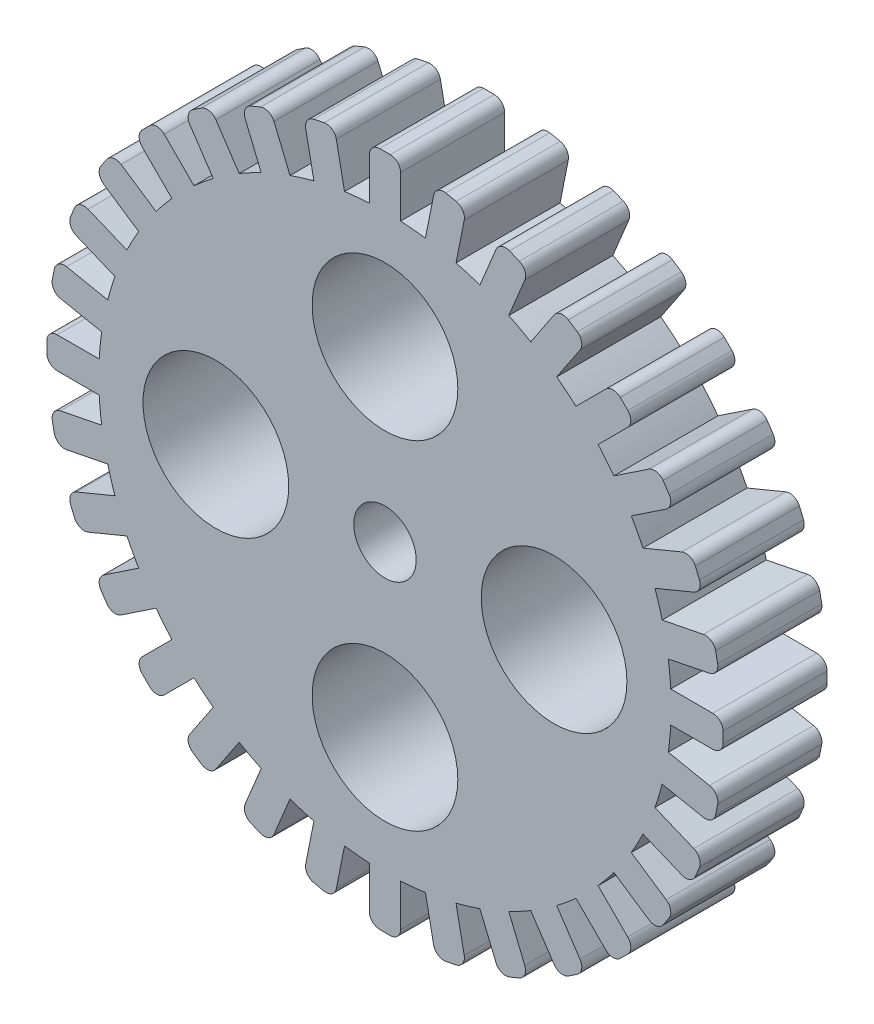
from build123d import *

# Parameters (mm, degrees)
SKETCH1_R           = 3
BOSS_EXTRUDE2_DEPTH = 10
FILLET1_R           = 1
SKETCH2_R           = 7
CUT_EXTRUDE1_DEPTH  = 24


with BuildPart() as part:
    # Sketch1 → Boss-Extrude2 (new body)
    with BuildSketch(Plane.XY):
        with BuildLine():
            Line((4.862500818, 32.134188737), (3.885819022, 27.224077772))
            ThreePointArc((3.885819022, 27.224077772), (2.695471359, 27.367579983), (1.5, 27.459060435))
            Line((1.5, 27.459060435), (1.5, 32.465366161))
            ThreePointArc((1.5, 32.465366161), (0, 32.5), (-1.5, 32.465366161))
            Line((-1.5, 32.465366161), (-1.5, 27.459060435))
            ThreePointArc((-1.5, 27.459060435), (-2.695471359, 27.367579983), (-3.885819022, 27.224077772))
            Line((-3.885819022, 27.224077772), (-4.862500818, 32.134188737))
            ThreePointArc((-4.862500818, 32.134188737), (-6.340435466, 31.875521613), (-7.804856659, 31.548917771))
            Line((-7.804856659, 31.548917771), (-6.828174863, 26.638806806))
            ThreePointArc((-6.828174863, 26.638806806), (-7.982828624, 26.315859233), (-9.122308198, 25.942889067))
            Line((-9.122308198, 25.942889067), (-11.038138457, 30.568112461))
            ThreePointArc((-11.038138457, 30.568112461), (-12.437211552, 30.026084807), (-13.809777054, 29.420062164))
            Line((-13.809777054, 29.420062164), (-11.893946796, 24.79483877))
            ThreePointArc((-11.893946796, 24.79483877), (-12.963410263, 24.25283477), (-14.008232186, 23.664729684))
            Line((-14.008232186, 23.664729684), (-16.789586625, 27.827320765))
            ThreePointArc((-16.789586625, 27.827320765), (-18.056032573, 27.0227624), (-19.283995462, 26.160610066))
            Line((-19.283995462, 26.160610066), (-16.502641023, 21.998018985))
            ThreePointArc((-16.502641023, 21.998018985), (-17.445815314, 21.257787467), (-18.355827667, 20.477148011))
            Line((-18.355827667, 20.477148011), (-21.895820395, 24.017140738))
            ThreePointArc((-21.895820395, 24.017140738), (-22.980970389, 22.980970389), (-24.017140738, 21.895820395))
            Line((-24.017140738, 21.895820395), (-20.477148011, 18.355827667))
            ThreePointArc((-20.477148011, 18.355827667), (-21.257787467, 17.445815315), (-21.998018985, 16.502641023))
            Line((-21.998018985, 16.502641023), (-26.160610066, 19.283995462))
            ThreePointArc((-26.160610066, 19.283995462), (-27.0227624, 18.056032573), (-27.827320765, 16.789586625))
            Line((-27.827320765, 16.789586625), (-23.664729684, 14.008232186))
            ThreePointArc((-23.664729684, 14.008232186), (-24.25283477, 12.963410263), (-24.79483877, 11.893946796))
            Line((-24.79483877, 11.893946796), (-29.420062164, 13.809777054))
            ThreePointArc((-29.420062164, 13.809777054), (-30.026084807, 12.437211552), (-30.568112461, 11.038138457))
            Line((-30.568112461, 11.038138457), (-25.942889067, 9.122308198))
            ThreePointArc((-25.942889067, 9.122308198), (-26.315859233, 7.982828624), (-26.638806806, 6.828174863))
            Line((-26.638806806, 6.828174863), (-31.548917771, 7.804856659))
            ThreePointArc((-31.548917771, 7.804856659), (-31.875521613, 6.340435466), (-32.134188737, 4.862500818))
            Line((-32.134188737, 4.862500818), (-27.224077772, 3.885819022))
            ThreePointArc((-27.224077772, 3.885819022), (-27.367579983, 2.695471359), (-27.459060435, 1.5))
            Line((-27.459060435, 1.5), (-32.465366161, 1.5))
            ThreePointArc((-32.465366161, 1.5), (-32.5, 0), (-32.465366161, -1.5))
            Line((-32.465366161, -1.5), (-27.459060435, -1.5))
            ThreePointArc((-27.459060435, -1.5), (-27.367579983, -2.695471359), (-27.224077772, -3.885819022))
            Line((-27.224077772, -3.885819022), (-32.134188737, -4.862500818))
            ThreePointArc((-32.134188737, -4.862500818), (-31.875521613, -6.340435466), (-31.548917771, -7.804856659))
            Line((-31.548917771, -7.804856659), (-26.638806806, -6.828174863))
            ThreePointArc((-26.638806806, -6.828174863), (-26.315859233, -7.982828624), (-25.942889067, -9.122308198))
            Line((-25.942889067, -9.122308198), (-30.568112461, -11.038138457))
            ThreePointArc((-30.568112461, -11.038138457), (-30.026084807, -12.437211552), (-29.420062164, -13.809777054))
            Line((-29.420062164, -13.809777054), (-24.79483877, -11.893946796))
            ThreePointArc((-24.79483877, -11.893946796), (-24.25283477, -12.963410263), (-23.664729684, -14.008232186))
            Line((-23.664729684, -14.008232186), (-27.827320765, -16.789586625))
            ThreePointArc((-27.827320765, -16.789586625), (-27.0227624, -18.056032573), (-26.160610066, -19.283995462))
            Line((-26.160610066, -19.283995462), (-21.998018985, -16.502641023))
            ThreePointArc((-21.998018985, -16.502641023), (-21.257787467, -17.445815315), (-20.477148011, -18.355827667))
            Line((-20.477148011, -18.355827667), (-24.017140738, -21.895820395))
            ThreePointArc((-24.017140738, -21.895820395), (-22.980970389, -22.980970389), (-21.895820395, -24.017140738))
            Line((-21.895820395, -24.017140738), (-18.355827667, -20.477148011))
            ThreePointArc((-18.355827667, -20.477148011), (-17.445815315, -21.257787467), (-16.502641023, -21.998018985))
            Line((-16.502641023, -21.998018985), (-19.283995462, -26.160610066))
            ThreePointArc((-19.283995462, -26.160610066), (-18.056032573, -27.0227624), (-16.789586625, -27.827320765))
            Line((-16.789586625, -27.827320765), (-14.008232186, -23.664729684))
            ThreePointArc((-14.008232186, -23.664729684), (-12.963410263, -24.25283477), (-11.893946796, -24.79483877))
            Line((-11.893946796, -24.79483877), (-13.809777054, -29.420062164))
            ThreePointArc((-13.809777054, -29.420062164), (-12.437211552, -30.026084807), (-11.038138457, -30.568112461))
            Line((-11.038138457, -30.568112461), (-9.122308198, -25.942889067))
            ThreePointArc((-9.122308198, -25.942889067), (-7.982828624, -26.315859233), (-6.828174863, -26.638806806))
            Line((-6.828174863, -26.638806806), (-7.804856659, -31.548917771))
            ThreePointArc((-7.804856659, -31.548917771), (-6.340435466, -31.875521613), (-4.862500818, -32.134188737))
            Line((-4.862500818, -32.134188737), (-3.885819022, -27.224077772))
            ThreePointArc((-3.885819022, -27.224077772), (-2.695471359, -27.367579983), (-1.5, -27.459060435))
            Line((-1.5, -27.459060435), (-1.5, -32.465366161))
            ThreePointArc((-1.5, -32.465366161), (0, -32.5), (1.5, -32.465366161))
            Line((1.5, -32.465366161), (1.5, -27.459060435))
            ThreePointArc((1.5, -27.459060435), (2.695471359, -27.367579983), (3.885819022, -27.224077772))
            Line((3.885819022, -27.224077772), (4.862500818, -32.134188737))
            ThreePointArc((4.862500818, -32.134188737), (6.340435466, -31.875521613), (7.804856659, -31.548917771))
            Line((7.804856659, -31.548917771), (6.828174863, -26.638806806))
            ThreePointArc((6.828174863, -26.638806806), (7.982828624, -26.315859233), (9.122308198, -25.942889067))
            Line((9.122308198, -25.942889067), (11.038138457, -30.568112461))
            ThreePointArc((11.038138457, -30.568112461), (12.437211552, -30.026084807), (13.809777054, -29.420062164))
            Line((13.809777054, -29.420062164), (11.893946796, -24.79483877))
            ThreePointArc((11.893946796, -24.79483877), (12.963410263, -24.25283477), (14.008232186, -23.664729684))
            Line((14.008232186, -23.664729684), (16.789586625, -27.827320765))
            ThreePointArc((16.789586625, -27.827320765), (18.056032573, -27.0227624), (19.283995462, -26.160610066))
            Line((19.283995462, -26.160610066), (16.502641023, -21.998018985))
            ThreePointArc((16.502641023, -21.998018985), (17.445815315, -21.257787467), (18.355827667, -20.477148011))
            Line((18.355827667, -20.477148011), (21.895820395, -24.017140738))
            ThreePointArc((21.895820395, -24.017140738), (22.980970389, -22.980970389), (24.017140738, -21.895820395))
            Line((24.017140738, -21.895820395), (20.477148011, -18.355827667))
            ThreePointArc((20.477148011, -18.355827667), (21.257787467, -17.445815315), (21.998018985, -16.502641023))
            Line((21.998018985, -16.502641023), (26.160610066, -19.283995462))
            ThreePointArc((26.160610066, -19.283995462), (27.0227624, -18.056032573), (27.827320765, -16.789586625))
            Line((27.827320765, -16.789586625), (23.664729684, -14.008232186))
            ThreePointArc((23.664729684, -14.008232186), (24.25283477, -12.963410263), (24.79483877, -11.893946796))
            Line((24.79483877, -11.893946796), (29.420062164, -13.809777054))
            ThreePointArc((29.420062164, -13.809777054), (30.026084807, -12.437211552), (30.568112461, -11.038138457))
            Line((30.568112461, -11.038138457), (25.942889067, -9.122308198))
            ThreePointArc((25.942889067, -9.122308198), (26.315859233, -7.982828624), (26.638806806, -6.828174863))
            Line((26.638806806, -6.828174863), (31.548917771, -7.804856659))
            ThreePointArc((31.548917771, -7.804856659), (31.875521613, -6.340435466), (32.134188737, -4.862500818))
            Line((32.134188737, -4.862500818), (27.224077772, -3.885819022))
            ThreePointArc((27.224077772, -3.885819022), (27.367579983, -2.695471359), (27.459060435, -1.5))
            Line((27.459060435, -1.5), (32.465366161, -1.5))
            ThreePointArc((32.465366161, -1.5), (32.5, 0), (32.465366161, 1.5))
            Line((32.465366161, 1.5), (27.459060435, 1.5))
            ThreePointArc((27.459060435, 1.5), (27.367579983, 2.695471359), (27.224077772, 3.885819022))
            Line((27.224077772, 3.885819022), (32.134188737, 4.862500818))
            ThreePointArc((32.134188737, 4.862500818), (31.875521613, 6.340435466), (31.548917771, 7.804856659))
            Line((31.548917771, 7.804856659), (26.638806806, 6.828174863))
            ThreePointArc((26.638806806, 6.828174863), (26.315859233, 7.982828624), (25.942889067, 9.122308198))
            Line((25.942889067, 9.122308198), (30.568112461, 11.038138457))
            ThreePointArc((30.568112461, 11.038138457), (30.026084807, 12.437211552), (29.420062164, 13.809777054))
            Line((29.420062164, 13.809777054), (24.79483877, 11.893946796))
            ThreePointArc((24.79483877, 11.893946796), (24.25283477, 12.963410263), (23.664729684, 14.008232186))
            Line((23.664729684, 14.008232186), (27.827320765, 16.789586625))
            ThreePointArc((27.827320765, 16.789586625), (27.0227624, 18.056032573), (26.160610066, 19.283995462))
            Line((26.160610066, 19.283995462), (21.998018985, 16.502641023))
            ThreePointArc((21.998018985, 16.502641023), (21.257787467, 17.445815315), (20.477148011, 18.355827667))
            Line((20.477148011, 18.355827667), (24.017140738, 21.895820395))
            ThreePointArc((24.017140738, 21.895820395), (22.980970389, 22.980970389), (21.895820395, 24.017140738))
            Line((21.895820395, 24.017140738), (18.355827667, 20.477148011))
            ThreePointArc((18.355827667, 20.477148011), (17.445815315, 21.257787467), (16.502641023, 21.998018985))
            Line((16.502641023, 21.998018985), (19.283995462, 26.160610066))
            ThreePointArc((19.283995462, 26.160610066), (18.056032573, 27.0227624), (16.789586625, 27.827320765))
            Line((16.789586625, 27.827320765), (14.008232186, 23.664729684))
            ThreePointArc((14.008232186, 23.664729684), (12.963410263, 24.25283477), (11.893946796, 24.79483877))
            Line((11.893946796, 24.79483877), (13.809777054, 29.420062164))
            ThreePointArc((13.809777054, 29.420062164), (12.437211552, 30.026084807), (11.038138457, 30.568112461))
            Line((11.038138457, 30.568112461), (9.122308198, 25.942889067))
            ThreePointArc((9.122308198, 25.942889067), (7.982828624, 26.315859233), (6.828174863, 26.638806806))
            Line((6.828174863, 26.638806806), (7.804856659, 31.548917771))
            ThreePointArc((7.804856659, 31.548917771), (6.340435466, 31.875521613), (4.862500818, 32.134188737))
        make_face()
        Circle(SKETCH1_R, mode=Mode.SUBTRACT)
    extrude(amount=BOSS_EXTRUDE2_DEPTH)

    # Fillet1
    fillet1_edges = [part.edges().sort_by_distance(p)[0] for p in [
        (27.827320765, -16.789586625, 5),
        (26.160610066, -19.283995462, 5),
        (24.017140738, -21.895820395, 5),
        (21.895820395, -24.017140738, 5),
        (19.283995462, -26.160610066, 5),
        (16.789586625, -27.827320765, 5),
        (13.809777054, -29.420062164, 5),
        (11.038138457, -30.568112461, 5),
        (7.804856659, -31.548917771, 5),
        (4.862500818, -32.134188737, 5),
        (1.5, -32.465366161, 5),
        (-1.5, -32.465366161, 5),
        (-4.862500818, -32.134188737, 5),
        (-7.804856659, -31.548917771, 5),
        (-11.038138457, -30.568112461, 5),
        (-13.809777054, -29.420062164, 5),
        (-16.789586625, -27.827320765, 5),
        (-19.283995462, -26.160610066, 5),
        (-21.895820395, -24.017140738, 5),
        (-24.017140738, -21.895820395, 5),
        (-26.160610066, -19.283995462, 5),
        (-27.827320765, -16.789586625, 5),
        (-29.420062164, -13.809777054, 5),
        (-30.568112461, -11.038138457, 5),
        (-31.548917771, -7.804856659, 5),
        (-32.134188737, -4.862500818, 5),
        (-32.465366161, -1.5, 5),
        (-32.465366161, 1.5, 5),
        (-32.134188737, 4.862500818, 5),
        (-31.548917771, 7.804856659, 5),
        (-30.568112461, 11.038138457, 5),
        (-29.420062164, 13.809777054, 5),
        (-27.827320765, 16.789586625, 5),
        (-26.160610066, 19.283995462, 5),
        (-24.017140738, 21.895820395, 5),
        (-21.895820395, 24.017140738, 5),
        (-19.283995462, 26.160610066, 5),
        (-16.789586625, 27.827320765, 5),
        (-13.809777054, 29.420062164, 5),
        (-11.038138457, 30.568112461, 5),
        (-7.804856659, 31.548917771, 5),
        (-4.862500818, 32.134188737, 5),
        (-1.5, 32.465366161, 5),
        (1.5, 32.465366161, 5),
        (4.862500818, 32.134188737, 5),
        (7.804856659, 31.548917771, 5),
        (11.038138457, 30.568112461, 5),
        (13.809777054, 29.420062164, 5),
        (16.789586625, 27.827320765, 5),
        (19.283995462, 26.160610066, 5),
        (21.895820395, 24.017140738, 5),
        (24.017140738, 21.895820395, 5),
        (26.160610066, 19.283995462, 5),
        (27.827320765, 16.789586625, 5),
        (29.420062164, 13.809777054, 5),
        (30.568112461, 11.038138457, 5),
        (31.548917771, 7.804856659, 5),
        (32.134188737, 4.862500818, 5),
        (32.465366161, 1.5, 5),
        (32.465366161, -1.5, 5),
        (32.134188737, -4.862500818, 5),
        (31.548917771, -7.804856659, 5),
        (30.568112461, -11.038138457, 5),
        (29.420062164, -13.809777054, 5),
    ]]
    fillet(fillet1_edges, radius=FILLET1_R)

    # Sketch2 → Cut-Extrude1 (cut)
    with BuildSketch(Plane.XY):
        with Locations((-16.25, 0)):
            Circle(SKETCH2_R)
        with Locations((0, -16.25)):
            Circle(SKETCH2_R)
        with Locations((0, 16.25)):
            Circle(SKETCH2_R)
        with BuildLine():
            ThreePointArc((23.25, 0), (16.25, 7), (9.25, 0))
            Line((9.25, 0), (23.25, 0))
        make_face()
        with BuildLine():
            Line((23.25, 0), (9.25, 0))
            ThreePointArc((9.25, 0), (16.25, -7), (23.25, 0))
        make_face()
    extrude(amount=CUT_EXTRUDE1_DEPTH, mode=Mode.SUBTRACT)


solid = part.part
